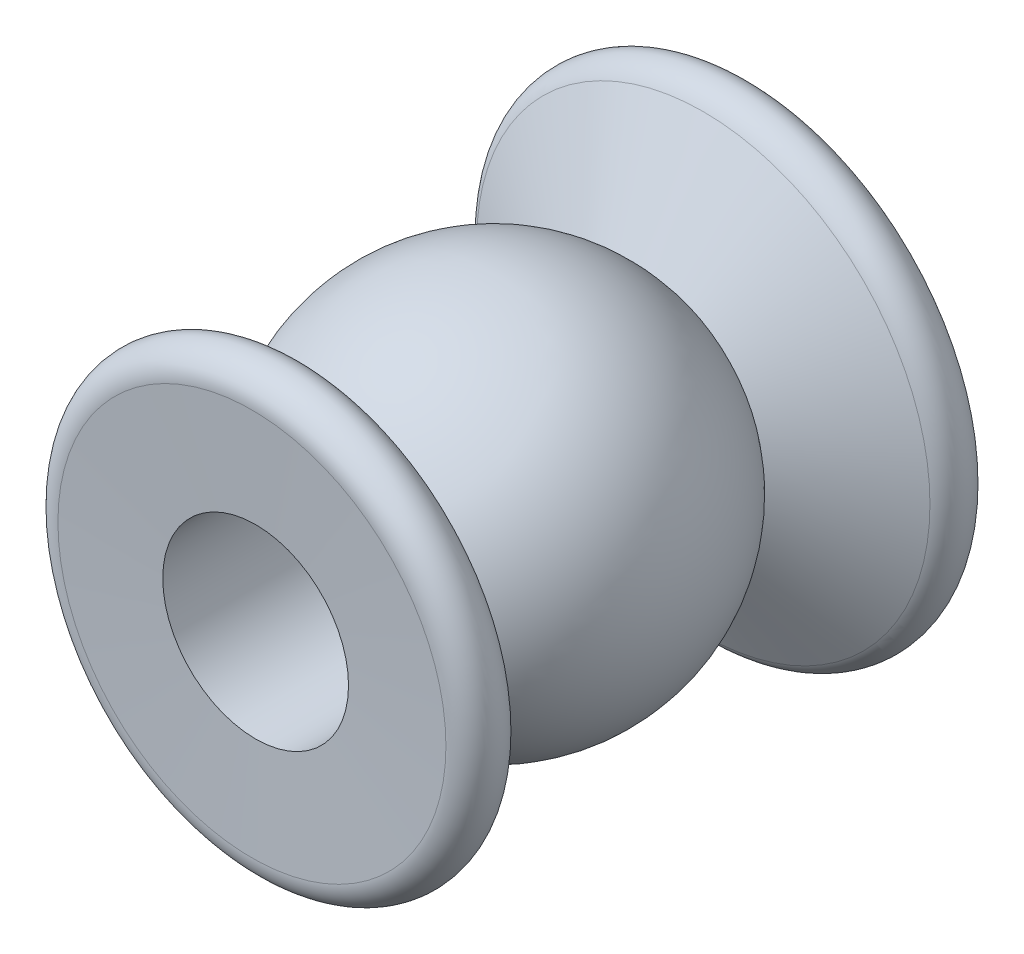
from build123d import *

# Parameters (mm, degrees)
SKETCH_2_R          = 3.5
CUT_EXTRUDE_1_DEPTH = 24


with BuildPart() as part:
    # 草图1 → 旋转1 (revolve)
    with BuildSketch(Plane(origin=(0, 0, 0), x_dir=(1, 0, 0), z_dir=(0, 1, 0))):
        with BuildLine():
            Line((4.47238179, 5.664226859), (8.542255744, 7.893258215))
            ThreePointArc((8.542255744, 7.893258215), (9.014848357, 9.073438454), (7.947303741, 9.763741043))
            Line((7.947303741, 9.763741043), (0, 8.847027754))
            Line((0, 8.847027754), (0, 3.743540559))
            Line((0, 3.743540559), (0, -3.743540559))
            Line((0, -3.743540559), (0, -8.847027754))
            Line((0, -8.847027754), (7.310640748, -9.114898963))
            ThreePointArc((7.310640748, -9.114898963), (8.319210693, -8.350743764), (7.771541106, -7.210040242))
            Line((7.771541106, -7.210040242), (4.47238179, -5.664226859))
            ThreePointArc((4.47238179, -5.664226859), (7.21703989, 0), (4.47238179, 5.664226859))
        make_face()
    revolve(axis=Axis((0, 0, 7.015647414), (0, 0, -1)))

    # 草图2 → 切除-拉伸1 (cut)
    with BuildSketch(Plane.XY.offset(-9.763741043)):
        with Locations(Location((0, 0, 0), (0, 0, 180))):
            Circle(SKETCH_2_R)
    extrude(amount=CUT_EXTRUDE_1_DEPTH, mode=Mode.SUBTRACT)


solid = part.part
